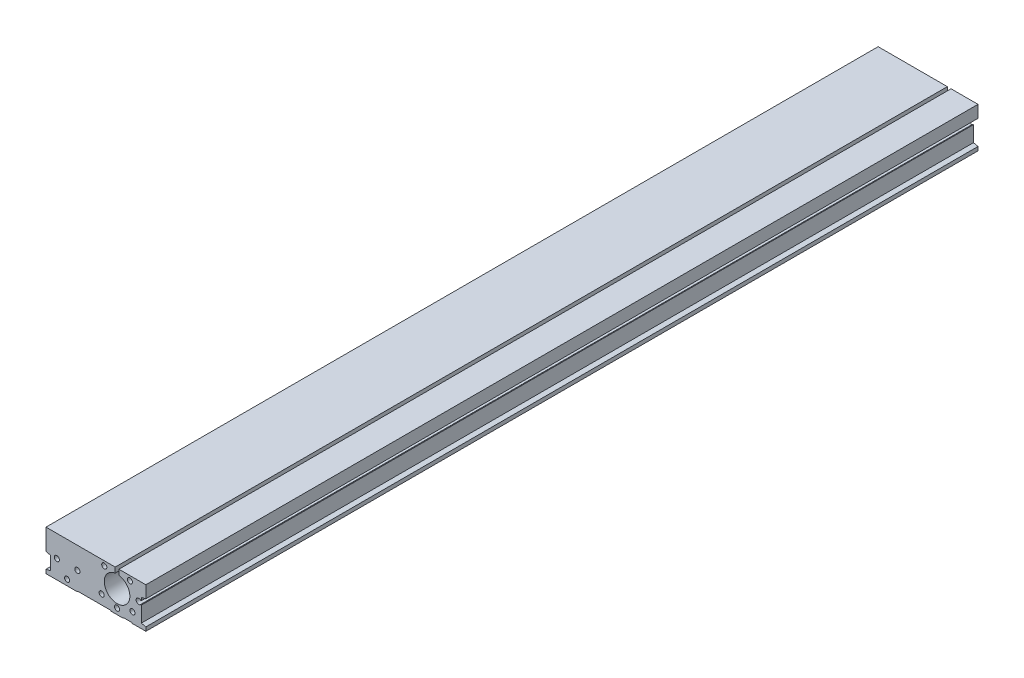
from build123d import *

# Parameters (mm, degrees)
BASE_DEPTH                = 325
BASE_DEPTH_BACK           = 325
BASE_SKETCH_W             = 78
BASE_SKETCH_H             = 31.5
BASE_SKETCH_R             = 10
BASE_GROOVE_DEPTH         = 331.168896173
BASE_GROOVE_DEPTH_BACK    = 331.168896173
SEAL_GROOVE_DEPTH         = 331.168896173
SEAL_GROOVE_DEPTH_BACK    = 331.168896173
HOLES_DEPTH               = 331.168896173
HOLES_DEPTH_BACK          = 331.168896173
HOLES_SKETCH_R            = 2
SWITCH_GROOVE1_DEPTH      = 331.168896173
SWITCH_GROOVE1_DEPTH_BACK = 331.168896173
SIDE_GROOVE1_DEPTH        = 331.168896173
SIDE_GROOVE1_DEPTH_BACK   = 331.168896173
SIDE_GROOVE2_DEPTH        = 331.168896173
SIDE_GROOVE2_DEPTH_BACK   = 331.168896173


with BuildPart() as part:
    # Base_Sketch → Base (new, two sides: drawn at the far end of the back side and taken through both)
    with BuildSketch(Plane.XY.offset(-BASE_DEPTH_BACK)):
        with Locations((-16.5, -1.75)):
            Rectangle(BASE_SKETCH_W, BASE_SKETCH_H)
        Circle(BASE_SKETCH_R, mode=Mode.SUBTRACT)
    extrude(amount=BASE_DEPTH + BASE_DEPTH_BACK)

    # Base_Groove_Sketch → Base_Groove (cut, two sides: drawn at the far end of the back side and taken through both)
    with BuildSketch(Plane.XY.offset(-BASE_GROOVE_DEPTH_BACK)):
        Polygon((12, -17.5), (11.133974596, -17), (5.366025404, -17), (4.5, -17.5), align=None)
        Polygon((-4.5, -17.5), (-5.366025404, -17), (-30.633974596, -17), (-31.5, -17.5), align=None)
    extrude(amount=BASE_GROOVE_DEPTH + BASE_GROOVE_DEPTH_BACK, mode=Mode.SUBTRACT)

    # Seal_Groove_Sketch → Seal_Groove (cut, two sides: drawn at the far end of the back side and taken through both)
    with BuildSketch(Plane.XY.offset(-SEAL_GROOVE_DEPTH_BACK)):
        with BuildLine():
            Line((-1.45, 14), (-1.45, 9.89431655))
            ThreePointArc((-1.45, 9.89431655), (0, 10), (1.45, 9.89431655))
            Line((1.45, 9.89431655), (1.45, 14))
            Line((1.45, 14), (-1.45, 14))
        make_face()
    extrude(amount=SEAL_GROOVE_DEPTH + SEAL_GROOVE_DEPTH_BACK, mode=Mode.SUBTRACT)

    # Holes_Sketch → Holes (cut, two sides: drawn at the far end of the back side and taken through both)
    with BuildSketch(Plane.XY.offset(-HOLES_DEPTH_BACK)):
        with Locations((12, -9.5)):
            Circle(HOLES_SKETCH_R)
        with Locations((-12, -9.5)):
            Circle(HOLES_SKETCH_R)
        with Locations((10, 10.5)):
            Circle(HOLES_SKETCH_R)
        with Locations(Location((-10, 10.5, 0), (0, 0, 180))):
            Circle(HOLES_SKETCH_R)
        with Locations((0, -13)):
            Circle(HOLES_SKETCH_R)
        with Locations((-31, -3)):
            Circle(HOLES_SKETCH_R)
        with Locations((-47, -3)):
            Circle(HOLES_SKETCH_R)
        with Locations((-39, -13)):
            Circle(HOLES_SKETCH_R)
    extrude(amount=HOLES_DEPTH + HOLES_DEPTH_BACK, mode=Mode.SUBTRACT)

    # Switch_Groove1_Sketch (on Front Plane) → Switch_Groove1 (cut, two sides: drawn at the far end of the back side and taken through both)
    with BuildSketch(Plane.XY.offset(-SWITCH_GROOVE1_DEPTH_BACK)):
        with BuildLine():
            Line((22.5, 1.5), (18.469693846, 1.5))
            ThreePointArc((18.469693846, 1.5), (14.9, 0), (18.469693846, -1.5))
            Line((18.469693846, -1.5), (22.5, -1.5))
            Line((22.5, -1.5), (22.5, 1.5))
        make_face()
    extrude(amount=SWITCH_GROOVE1_DEPTH + SWITCH_GROOVE1_DEPTH_BACK, mode=Mode.SUBTRACT)

    # Side_Groove1_Sketch → Side_Groove1 (cut, two sides: drawn at the far end of the back side and taken through both)
    with BuildSketch(Plane.XY.offset(-SIDE_GROOVE1_DEPTH_BACK)):
        Polygon((-55.5, -14.5), (-52, -13.691961331), (-52, -3.308038669), (-55.5, -2.5), align=None)
    extrude(amount=SIDE_GROOVE1_DEPTH + SIDE_GROOVE1_DEPTH_BACK, mode=Mode.SUBTRACT)

    # Side_Groove2_Sketch → Side_Groove2 (cut, two sides: drawn at the far end of the back side and taken through both)
    with BuildSketch(Plane.XY.offset(-SIDE_GROOVE2_DEPTH_BACK)):
        Polygon((22.5, 4.5), (19, 3.691961331), (19, -13.691961331), (22.5, -14.5), align=None)
    extrude(amount=SIDE_GROOVE2_DEPTH + SIDE_GROOVE2_DEPTH_BACK, mode=Mode.SUBTRACT)


solid = part.part
